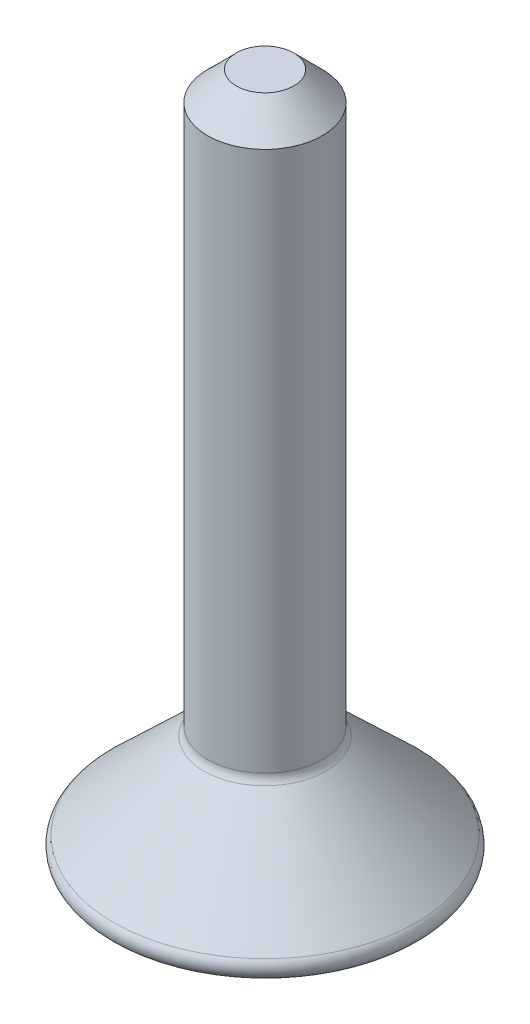
from build123d import *

# Parameters (mm, degrees)
SKETCH_2_R          = 1
EXTRUDE_1_DEPTH     = 10
CUT_EXTRUDE_1_DEPTH = 1
CHAMFER_1_SIZE      = 0.5
FILLET_1_R          = 0.2


with BuildPart() as part:
    # 草图1 → 旋转2 (revolve)
    with BuildSketch(Plane.XY, mode=Mode.PRIVATE) as revolve_2_sk:
        Polygon((0, 1.9), (1, 1.9), (3, 0), (0, 0), align=None)
    revolve(revolve_2_sk.sketch.rotate(Axis((0, 3.310292653, 0), (0, -1, 0)), 270), axis=Axis((0, 3.310292653, 0), (0, -1, 0)))

    # 草图2 → 凸台-拉伸1 (add)
    with BuildSketch(Plane(origin=(0, 1.9, 0), x_dir=(1, 0, 0), z_dir=(0, 1, 0))):
        with Locations(Location((0, 0, 0), (0, 0, 90))):
            Circle(SKETCH_2_R)
    extrude(amount=EXTRUDE_1_DEPTH)

    # 草图3 → 切除-拉伸1 (cut)
    with BuildSketch(Plane.XZ):
        Polygon((0, 1.154700538), (-1, 0.577350269), (-1, -0.577350269), (0, -1.154700538), (1, -0.577350269), (1, 0.577350269), align=None)
    extrude(amount=-CUT_EXTRUDE_1_DEPTH, mode=Mode.SUBTRACT)

    # 倒角1
    chamfer_1_edges = [part.edges().sort_by_distance(p)[0] for p in [
        (0, 11.9, 1),
    ]]
    chamfer(chamfer_1_edges, length=CHAMFER_1_SIZE)

    # 圆角1
    fillet_1_edges = [part.edges().sort_by_distance(p)[0] for p in [
        (0, 0, 3),
        (0, 1.9, 1),
    ]]
    fillet(fillet_1_edges, radius=FILLET_1_R)


solid = part.part
